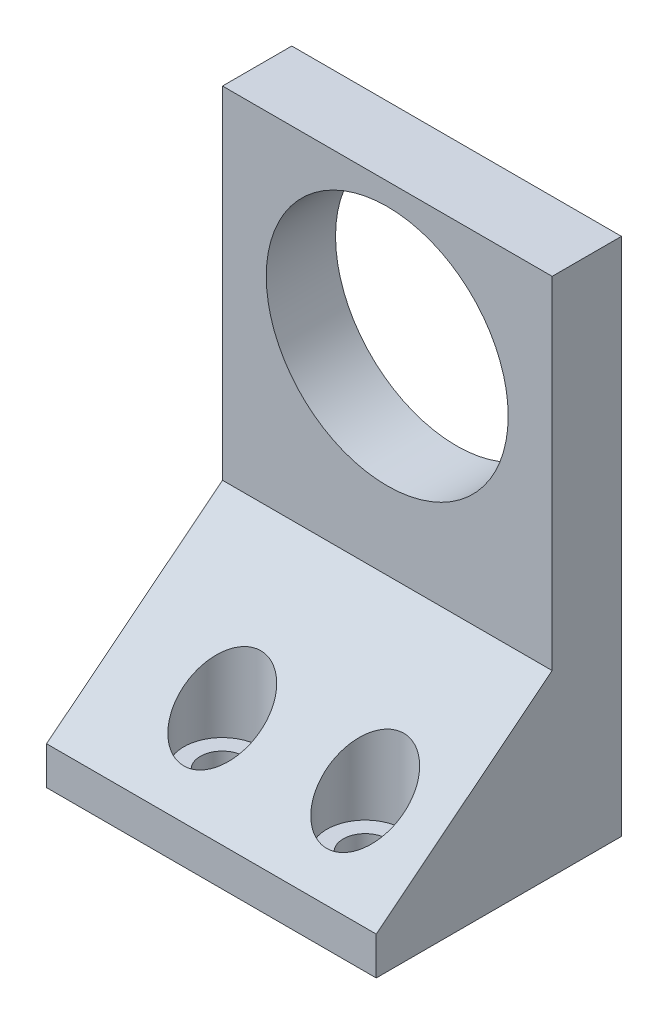
from build123d import *

# Parameters (mm, degrees)
SKETCH1_W            = 93
SKETCH1_H            = 100
BOSS_EXTRUDE2_DEPTH  = 10
SKETCH4_W            = 10.01
SKETCH4_H            = 15
BOSS_EXTRUDE4_DEPTH  = 24
SKETCH5_R            = 2
CUT_EXTRUDE1_DEPTH   = 50
SKETCH7_R            = 11
CUT_EXTRUDE3_DEPTH   = 50
SKETCH14_W           = 61.5
SKETCH14_H           = 42
CUT_EXTRUDE8_DEPTH   = 4
SKETCH19_R           = 11
CUT_EXTRUDE11_DEPTH  = 15
SKETCH20_R           = 2
CUT_EXTRUDE12_DEPTH  = 10
SKETCH21_W           = 40
SKETCH21_H           = 6
BOSS_EXTRUDE5_DEPTH  = 27
SKETCH22_W           = 40
SKETCH22_H           = 6.3
BOSS_EXTRUDE7_DEPTH  = 40
SKETCH23_R           = 8
CUT_EXTRUDE13_DEPTH  = 40
SKETCH24_W           = 118.277817783
SKETCH24_H           = 41.8
CUT_EXTRUDE14_DEPTH  = 40
SKETCH25_W           = 31.5
SKETCH25_H           = 23.2
CUT_EXTRUDE15_DEPTH  = 20
CUT_EXTRUDE18_DEPTH  = 3
SKETCH27_R           = 4.1
SKETCH27_R_2         = 4
CUT_EXTRUDE29_DEPTH  = 3
SKETCH28_W           = 29.5
SKETCH28_H           = 58.2
CUT_EXTRUDE30_DEPTH  = 23
SKETCH29_W           = 32
SKETCH29_H           = 4
CUT_EXTRUDE31_DEPTH  = 23
SKETCH31_W           = 32
SKETCH31_H           = 6
BOSS_EXTRUDE9_DEPTH  = 6.6
SKETCH32_W           = 32
SKETCH32_H           = 6
BOSS_EXTRUDE10_DEPTH = 10
SKETCH33_R           = 2
CUT_EXTRUDE32_DEPTH  = 10
BOSS_EXTRUDE11_START = -32
BOSS_EXTRUDE11_DEPTH = 32
SKETCH35_R           = 3.5
CUT_EXTRUDE33_DEPTH  = 10
SKETCH36_W           = 40
SKETCH36_H           = 6.3
BOSS_EXTRUDE12_DEPTH = 18.8
SKETCH37_W           = 40
SKETCH37_H           = 6
BOSS_EXTRUDE13_DEPTH = 16
SKETCH38_R           = 2
CUT_EXTRUDE34_DEPTH  = 16
BOSS_EXTRUDE14_DEPTH = 40
SKETCH40_R           = 3.5
CUT_EXTRUDE35_DEPTH  = 16
SKETCH41_W           = 16
SKETCH41_H           = 64.8
CUT_EXTRUDE36_DEPTH  = 76
SKETCH42_W           = 20.7
SKETCH42_H           = 6
CUT_EXTRUDE37_DEPTH  = 76
SKETCH43_W           = 10.32098901
SKETCH43_H           = 73.075116481
CUT_EXTRUDE38_DEPTH  = 30
SKETCH44_W           = 2
SKETCH44_H           = 70.783229749
CUT_EXTRUDE39_DEPTH  = 30
SKETCH45_W           = 27.67901099
SKETCH45_H           = 15
CUT_EXTRUDE40_DEPTH  = 30
SKETCH46_W           = 27.67901099
SKETCH46_H           = 2.54
CUT_EXTRUDE41_DEPTH  = 110
SKETCH47_R           = 11
CUT_EXTRUDE42_DEPTH  = 20
BOSS_EXTRUDE16_DEPTH = 2.3


with BuildPart() as part:
    # Sketch1 → Boss-Extrude2 (new body)
    with BuildSketch(Plane.XY):
        with Locations((-29.68705036, 14.928057554)):
            Rectangle(SKETCH1_W, SKETCH1_H)
    extrude(amount=BOSS_EXTRUDE2_DEPTH)

    # Sketch4 → Boss-Extrude4 (add)
    with BuildSketch(Plane(origin=(16.81294964, 0, 0), x_dir=(0, 0, -1), z_dir=(1, 0, 0))):
        with Locations((-4.995, -12.571942446)):
            Rectangle(SKETCH4_W, SKETCH4_H)
    extrude(amount=BOSS_EXTRUDE4_DEPTH)

    # Sketch5 → Cut-Extrude1 (cut)
    with BuildSketch(Plane(origin=(0, -5.071942446, 0), x_dir=(1, 0, 0), z_dir=(0, 1, 0))):
        with Locations(Location((26.81294964, -5, 0), (0, 0, 180))):
            Circle(SKETCH5_R)
    extrude(amount=-CUT_EXTRUDE1_DEPTH, mode=Mode.SUBTRACT)

    # Sketch7 → Cut-Extrude3 (cut)
    with BuildSketch(Plane(origin=(0, 0, 0), x_dir=(-1, 0, 0), z_dir=(0, 0, -1))):
        with Locations((24.18705036, 36.928057554)):
            Circle(SKETCH7_R)
    extrude(amount=-CUT_EXTRUDE3_DEPTH, mode=Mode.SUBTRACT)

    # Sketch14 → Cut-Extrude8 (cut)
    with BuildSketch(Plane.XY.offset(10)):
        with Locations((-13.93705036, 36.789132279)):
            Rectangle(SKETCH14_W, SKETCH14_H)
    extrude(amount=-CUT_EXTRUDE8_DEPTH, mode=Mode.SUBTRACT)

    # Sketch19 → Cut-Extrude11 (cut)
    with BuildSketch(Plane(origin=(0, 0, 0), x_dir=(-1, 0, 0), z_dir=(0, 0, -1))):
        with Locations((53.18705036, 36.928057554)):
            Circle(SKETCH19_R)
    extrude(amount=-CUT_EXTRUDE11_DEPTH, mode=Mode.SUBTRACT)

    # Sketch20 → Cut-Extrude12 (cut)
    with BuildSketch(Plane.XY.offset(6)):
        with Locations((-34.68705036, 50.928057554)):
            Circle(SKETCH20_R)
        with Locations((5.31294964, 50.928057554)):
            Circle(SKETCH20_R)
        with Locations((-34.68705036, 22.928057554)):
            Circle(SKETCH20_R)
        with Locations((5.31294964, 22.928057554)):
            Circle(SKETCH20_R)
    extrude(amount=-CUT_EXTRUDE12_DEPTH, mode=Mode.SUBTRACT)

    # Sketch21 → Boss-Extrude5 (add)
    with BuildSketch(Plane(origin=(0, 0, 0), x_dir=(-1, 0, 0), z_dir=(0, 0, -1))):
        with Locations((56.18705036, 61.928057554)):
            Rectangle(SKETCH21_W, SKETCH21_H)
    extrude(amount=BOSS_EXTRUDE5_DEPTH)

    # Sketch22 → Boss-Extrude7 (add)
    with BuildSketch(Plane.XZ.offset(-58.928057554)):
        with Locations((-56.18705036, -23.85)):
            Rectangle(SKETCH22_W, SKETCH22_H)
    extrude(amount=BOSS_EXTRUDE7_DEPTH)

    # Sketch23 → Cut-Extrude13 (cut)
    with BuildSketch(Plane.XY.offset(10)):
        with Locations((-53.18705036, 36.928057554)):
            Circle(SKETCH23_R)
    extrude(amount=-CUT_EXTRUDE13_DEPTH, mode=Mode.SUBTRACT)

    # Sketch24 → Cut-Extrude14 (cut)
    with BuildSketch(Plane.XY.offset(10)):
        with Locations((-17.048141468, -14.171942446)):
            Rectangle(SKETCH24_W, SKETCH24_H)
    extrude(amount=-CUT_EXTRUDE14_DEPTH, mode=Mode.SUBTRACT)

    # Sketch25 → Cut-Extrude15 (cut)
    with BuildSketch(Plane.XY.offset(10)):
        with Locations((-60.43705036, 18.328057554)):
            Rectangle(SKETCH25_W, SKETCH25_H)
    extrude(amount=-CUT_EXTRUDE15_DEPTH, mode=Mode.SUBTRACT)

    # Sketch26 → Cut-Extrude18 (cut)
    with BuildSketch(Plane.XY.offset(6)):
        with BuildLine():
            Line((14.30212304, 57.789132279), (6.863398886, 57.789132279))
            Line((6.863398886, 57.789132279), (6.863398886, 54.615347499))
            ThreePointArc((6.863398886, 54.615347499), (8.24773413, 53.645968516), (9.108195728, 52.191428892))
            Line((9.108195728, 52.191428892), (14.30212304, 52.191428892))
            Line((14.30212304, 52.191428892), (14.30212304, 57.789132279))
        make_face()
        with BuildLine():
            Line((6.863398886, 19.240767609), (6.863398886, 15.789132279))
            Line((6.863398886, 15.789132279), (14.30212304, 15.789132279))
            Line((14.30212304, 15.789132279), (14.30212304, 20.928057554))
            Line((14.30212304, 20.928057554), (8.777051255, 20.928057554))
            ThreePointArc((8.777051255, 20.928057554), (7.95835451, 19.927752057), (6.863398886, 19.240767609))
        make_face()
        with BuildLine():
            Line((-36.237499605, 57.789132279), (-44.68705036, 57.789132279))
            Line((-44.68705036, 57.789132279), (-44.68705036, 52.191428892))
            Line((-44.68705036, 52.191428892), (-38.482296447, 52.191428892))
            ThreePointArc((-38.482296447, 52.191428892), (-37.621834849, 53.645968516), (-36.237499605, 54.615347499))
            Line((-36.237499605, 54.615347499), (-36.237499605, 57.789132279))
        make_face()
        with BuildLine():
            Line((-44.68705036, 21.664686216), (-44.68705036, 15.789132279))
            Line((-44.68705036, 15.789132279), (-36.237499605, 15.789132279))
            Line((-36.237499605, 15.789132279), (-36.237499605, 19.240767609))
            ThreePointArc((-36.237499605, 19.240767609), (-37.621834849, 20.210146592), (-38.482296447, 21.664686216))
            Line((-38.482296447, 21.664686216), (-44.68705036, 21.664686216))
        make_face()
    extrude(amount=-CUT_EXTRUDE18_DEPTH, mode=Mode.SUBTRACT)

    # Sketch27 → Cut-Extrude29 (cut)
    with BuildSketch(Plane.XY.offset(6)):
        with Locations((5.31294964, 50.928057554)):
            Circle(SKETCH27_R)
        with Locations((5.31294964, 22.928057554)):
            Circle(SKETCH27_R_2)
        with Locations((-34.68705036, 50.928057554)):
            Circle(SKETCH27_R)
        with Locations((-34.68705036, 22.928057554)):
            Circle(SKETCH27_R)
    extrude(amount=-CUT_EXTRUDE29_DEPTH, mode=Mode.SUBTRACT)

    # Sketch28 → Cut-Extrude30 (cut)
    with BuildSketch(Plane(origin=(0, 0, 0), x_dir=(-1, 0, 0), z_dir=(0, 0, -1))):
        with Locations((-2.06294964, 35.828057554)):
            Rectangle(SKETCH28_W, SKETCH28_H)
    extrude(amount=-CUT_EXTRUDE30_DEPTH, mode=Mode.SUBTRACT)

    # Sketch29 → Cut-Extrude31 (cut)
    with BuildSketch(Plane(origin=(0, 15.789132279, 0), x_dir=(1, 0, 0), z_dir=(0, 1, 0))):
        with Locations((-28.68705036, -8)):
            Rectangle(SKETCH29_W, SKETCH29_H)
    extrude(amount=-CUT_EXTRUDE31_DEPTH, mode=Mode.SUBTRACT)

    # Sketch31 → Boss-Extrude9 (add)
    with BuildSketch(Plane.XZ.offset(-6.728057554)):
        with Locations((-28.68705036, 3)):
            Rectangle(SKETCH31_W, SKETCH31_H)
    extrude(amount=BOSS_EXTRUDE9_DEPTH)

    # Sketch32 → Boss-Extrude10 (add)
    with BuildSketch(Plane.XY.offset(6)):
        with Locations((-28.68705036, 3.128057554)):
            Rectangle(SKETCH32_W, SKETCH32_H)
    extrude(amount=BOSS_EXTRUDE10_DEPTH)

    # Sketch33 → Cut-Extrude32 (cut)
    with BuildSketch(Plane(origin=(0, 6.128057554, 0), x_dir=(1, 0, 0), z_dir=(0, 1, 0))):
        with Locations(Location((-37.68705036, -11, 0), (0, 0, 270))):
            Circle(SKETCH33_R)
        with Locations(Location((-19.68705036, -11, 0), (0, 0, 270))):
            Circle(SKETCH33_R)
    extrude(amount=-CUT_EXTRUDE32_DEPTH, mode=Mode.SUBTRACT)

    # Sketch34 → Boss-Extrude11 (add)
    with BuildSketch(Plane(origin=(-12.68705036, 0, 0), x_dir=(0, 0, -1), z_dir=(1, 0, 0)).offset(BOSS_EXTRUDE11_START)):
        Polygon((-16, 6.128057554), (-6, 6.128057554), (-6, 14.058360342), align=None)
    extrude(amount=BOSS_EXTRUDE11_DEPTH)

    # Sketch35 → Cut-Extrude33 (cut)
    with BuildSketch(Plane.XZ.offset(-6.128057554)):
        with Locations((-19.68705036, 11)):
            Circle(SKETCH35_R)
        with Locations((-37.68705036, 11)):
            Circle(SKETCH35_R)
    extrude(amount=-CUT_EXTRUDE33_DEPTH, mode=Mode.SUBTRACT)

    # Sketch36 → Boss-Extrude12 (add)
    with BuildSketch(Plane.XZ.offset(-18.928057554)):
        with Locations((-56.18705036, -23.85)):
            Rectangle(SKETCH36_W, SKETCH36_H)
    extrude(amount=BOSS_EXTRUDE12_DEPTH)

    # Sketch37 → Boss-Extrude13 (add)
    with BuildSketch(Plane.XY.offset(-20.7)):
        with Locations((-56.18705036, 3.128057554)):
            Rectangle(SKETCH37_W, SKETCH37_H)
    extrude(amount=BOSS_EXTRUDE13_DEPTH)

    # Sketch38 → Cut-Extrude34 (cut)
    with BuildSketch(Plane(origin=(0, 6.128057554, 0), x_dir=(1, 0, 0), z_dir=(0, 1, 0))):
        with Locations(Location((-58.18705036, 10.7, 0), (0, 0, 180))):
            Circle(SKETCH38_R)
        with Locations(Location((-45.18705036, 10.7, 0), (0, 0, 180))):
            Circle(SKETCH38_R)
    extrude(amount=-CUT_EXTRUDE34_DEPTH, mode=Mode.SUBTRACT)

    # Sketch39 → Boss-Extrude14 (add)
    with BuildSketch(Plane(origin=(-36.18705036, 0, 0), x_dir=(0, 0, -1), z_dir=(1, 0, 0))):
        Polygon((4.7, 6.128057554), (20.7, 18.878141719), (20.7, 6.128057554), align=None)
    extrude(amount=-BOSS_EXTRUDE14_DEPTH)

    # Sketch40 → Cut-Extrude35 (cut)
    with BuildSketch(Plane.XZ.offset(-6.128057554)):
        with Locations(Location((-45.18705036, -10.7, 0), (0, 0, 270))):
            Circle(SKETCH40_R)
        with Locations(Location((-58.18705036, -10.7, 0), (0, 0, 270))):
            Circle(SKETCH40_R)
    extrude(amount=-CUT_EXTRUDE35_DEPTH, mode=Mode.SUBTRACT)

    # Sketch41 → Cut-Extrude36 (cut)
    with BuildSketch(Plane(origin=(-12.68705036, 0, 0), x_dir=(0, 0, -1), z_dir=(1, 0, 0))):
        with Locations((-8, 32.528057554)):
            Rectangle(SKETCH41_W, SKETCH41_H)
    extrude(amount=-CUT_EXTRUDE36_DEPTH, mode=Mode.SUBTRACT)

    # Sketch42 → Cut-Extrude37 (cut)
    with BuildSketch(Plane(origin=(-36.18705036, 0, 0), x_dir=(0, 0, -1), z_dir=(1, 0, 0))):
        with Locations((10.35, 61.928057554)):
            Rectangle(SKETCH42_W, SKETCH42_H)
    extrude(amount=-CUT_EXTRUDE37_DEPTH, mode=Mode.SUBTRACT)

    # Sketch43 → Cut-Extrude38 (cut)
    with BuildSketch(Plane.XY.offset(-4.7)):
        with Locations((-71.026555855, 36.665615794)):
            Rectangle(SKETCH43_W, SKETCH43_H)
    extrude(amount=-CUT_EXTRUDE38_DEPTH, mode=Mode.SUBTRACT)

    # Sketch44 → Cut-Extrude39 (cut)
    with BuildSketch(Plane.XY.offset(-4.7)):
        with Locations((-37.18705036, 35.519672429)):
            Rectangle(SKETCH44_W, SKETCH44_H)
    extrude(amount=-CUT_EXTRUDE39_DEPTH, mode=Mode.SUBTRACT)

    # Sketch45 → Cut-Extrude40 (cut)
    with BuildSketch(Plane.XY.offset(-20.7)):
        with Locations((-52.026555855, 57.428057554)):
            Rectangle(SKETCH45_W, SKETCH45_H)
    extrude(amount=-CUT_EXTRUDE40_DEPTH, mode=Mode.SUBTRACT)

    # Sketch46 → Cut-Extrude41 (cut)
    with BuildSketch(Plane.XY.offset(-4.7)):
        with Locations((-52.026555855, 1.398057554)):
            Rectangle(SKETCH46_W, SKETCH46_H)
    extrude(amount=-CUT_EXTRUDE41_DEPTH, mode=Mode.SUBTRACT)

    # Sketch47 → Cut-Extrude42 (cut)
    with BuildSketch(Plane.XY.offset(-20.7)):
        with Locations((-53.18705036, 36.928057554)):
            Circle(SKETCH47_R)
    extrude(amount=-CUT_EXTRUDE42_DEPTH, mode=Mode.SUBTRACT)

    # Sketch48 → Boss-Extrude16 (add)
    with BuildSketch(Plane.ZY.offset(65.86606135)):
        Polygon((-27, 49.928057554), (-20.7, 49.928057554), (-20.7, 18.878141719), (-4.7, 6.128057554), (-4.7, 2.668057554), (-27, 2.668057554), align=None)
    extrude(amount=BOSS_EXTRUDE16_DEPTH)


solid = part.part
